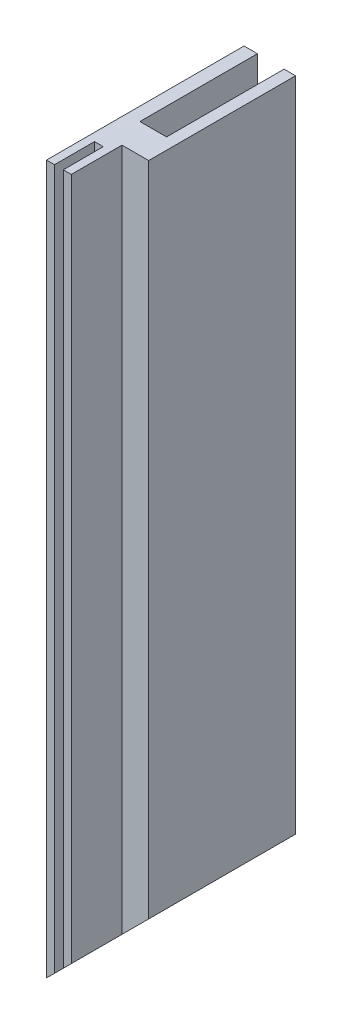
from build123d import *

# Parameters (mm, degrees)
BOSS_EXTRUDE1_DEPTH = 265.3
SKETCH2_W           = 10
SKETCH2_H           = 44
CUT_EXTRUDE1_DEPTH  = 10
SKETCH3_W           = 271.149403365
SKETCH3_H           = 159.03985052
CUT_EXTRUDE2_DEPTH  = 31
SKETCH4_W           = 28
SKETCH4_H           = 7
CUT_EXTRUDE3_DEPTH  = 8
SKETCH5_W           = 28.4
SKETCH5_H           = 7.4
CUT_EXTRUDE4_DEPTH  = 8


with BuildPart() as part:
    # Sketch1 → Boss-Extrude1 (new body)
    with BuildSketch(Plane(origin=(0, 0, 0), x_dir=(1, 0, 0), z_dir=(0, 1, 0))):
        Polygon((-51.505795374, 37), (-32.205795374, 37), (-32.205795374, -18), (-42.205795374, -18), (-42.205795374, -37), (-45.205795374, -37), (-45.205795374, -22), (-48.505795374, -22), (-48.505795374, -37), (-51.505795374, -37), align=None)
    extrude(amount=BOSS_EXTRUDE1_DEPTH)

    # Sketch2 → Cut-Extrude1 (cut)
    with BuildSketch(Plane(origin=(0, 265.3, 0), x_dir=(1, 0, 0), z_dir=(0, 1, 0))):
        with Locations((-41.505795374, 15)):
            Rectangle(SKETCH2_W, SKETCH2_H)
    extrude(amount=-CUT_EXTRUDE1_DEPTH, mode=Mode.SUBTRACT)

    # Sketch3 → Cut-Extrude2 (cut)
    with BuildSketch(Plane(origin=(-25.752897687, 25.752897687, 0), x_dir=(0, 0, 1), z_dir=(0.7071067811865488, -0.7071067811865464, 0))):
        with Locations((3.075588753, 19.523863597)):
            Rectangle(SKETCH3_W, SKETCH3_H)
    extrude(amount=CUT_EXTRUDE2_DEPTH, mode=Mode.SUBTRACT)

    # Sketch4 → Cut-Extrude3 (cut)
    with BuildSketch(Plane(origin=(-25.752897687, 25.752897687, 0), x_dir=(0, 0, -1), z_dir=(0.7071067811865487, -0.7071067811865465, 0))):
        with Locations((11, -18.625775426)):
            Rectangle(SKETCH4_W, SKETCH4_H)
    extrude(amount=-CUT_EXTRUDE3_DEPTH, mode=Mode.SUBTRACT)

    # Sketch5 → Cut-Extrude4 (cut)
    with BuildSketch(Plane(origin=(-25.752897687, 25.752897687, 0), x_dir=(0, 0, -1), z_dir=(0.7071067811865487, -0.7071067811865465, 0))):
        with Locations((11, -18.625775426)):
            Rectangle(SKETCH5_W, SKETCH5_H)
    extrude(amount=-CUT_EXTRUDE4_DEPTH, mode=Mode.SUBTRACT)


solid = part.part
